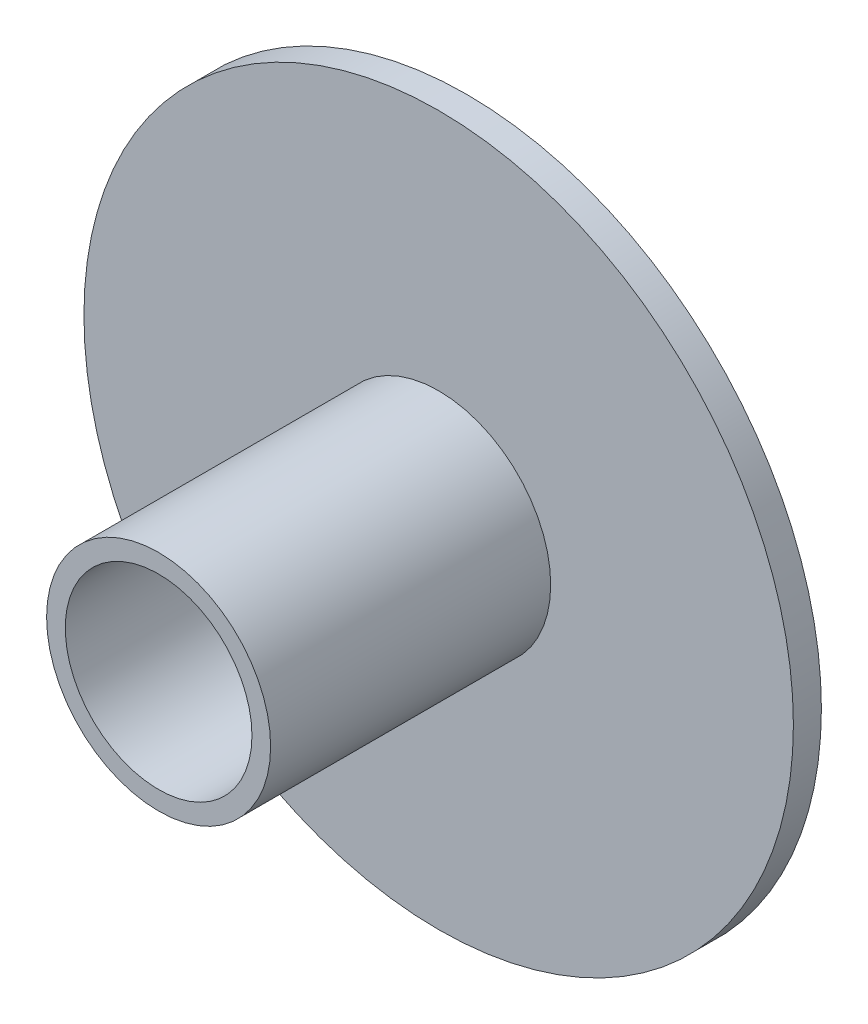
from build123d import *

# Parameters (mm, degrees)
SKETCH1_R               = 19
BOSS_EXTRUDE1_DEPTH     = 1.5
SKETCH2_R               = 6
BOSS_EXTRUDE2_DEPTH     = 15
CUT_EXTRUDE1_DEPTH      = 32.531730051
CUT_EXTRUDE1_DEPTH_BACK = 32.531730051
SKETCH3_R               = 5


with BuildPart() as part:
    # Sketch1 → Boss-Extrude1 (new body)
    with BuildSketch(Plane.XY):
        Circle(SKETCH1_R)
    extrude(amount=BOSS_EXTRUDE1_DEPTH)

    # Sketch2 → Boss-Extrude2 (add)
    with BuildSketch(Plane.XY.offset(1.5)):
        Circle(SKETCH2_R)
    extrude(amount=BOSS_EXTRUDE2_DEPTH)

    # Sketch3 → Cut-Extrude1 (cut, two sides: drawn at the far end of the back side and taken through both)
    with BuildSketch(Plane.XY.offset(16.5).offset(-CUT_EXTRUDE1_DEPTH_BACK)):
        Circle(SKETCH3_R)
    extrude(amount=CUT_EXTRUDE1_DEPTH + CUT_EXTRUDE1_DEPTH_BACK, mode=Mode.SUBTRACT)


solid = part.part
